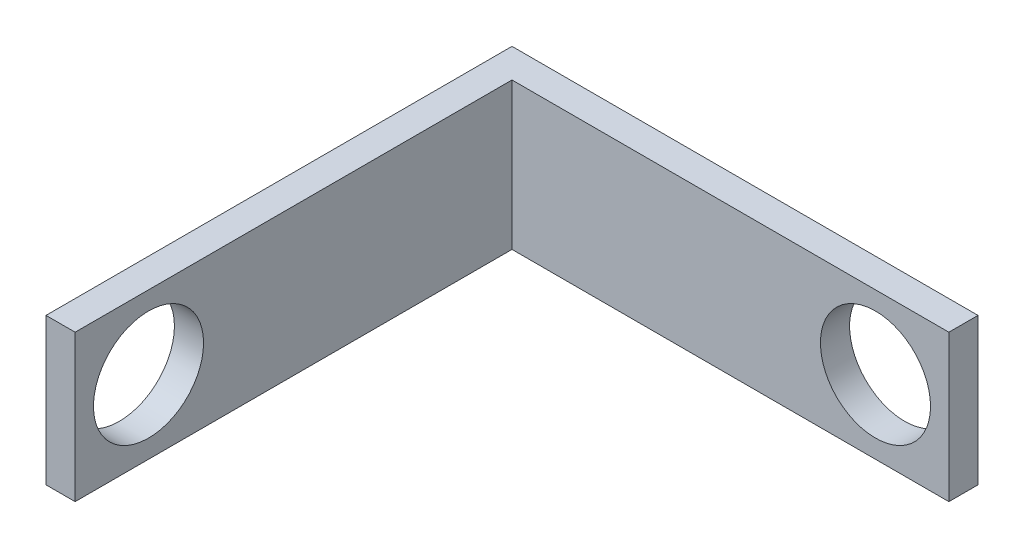
from build123d import *

# Parameters (mm, degrees)
BOSS_EXTRUDE1_DEPTH = 4
SKETCH2_R           = 3
CUT_EXTRUDE1_DEPTH  = 33.264456547
SKETCH3_R           = 3
CUT_EXTRUDE2_DEPTH  = 33.264456547


with BuildPart() as part:
    # Sketch1 → Boss-Extrude1 (new, symmetric)
    with BuildSketch(Plane(origin=(0, 0, 0), x_dir=(1, 0, 0), z_dir=(0, 1, 0))):
        Polygon((-4, 19.8125), (4, 19.8125), (4, 21.4), (-4, 21.4), (-21.4, 21.4), (-21.4, 4), (-21.4, -4), (-19.8125, -4), (-19.8125, 4), (-19.8125, 19.8125), align=None)
    extrude(amount=BOSS_EXTRUDE1_DEPTH, both=True)

    # Sketch2 → Cut-Extrude1 (cut, through all)
    with BuildSketch(Plane(origin=(-19.8125, 0, 0), x_dir=(0, 0, -1), z_dir=(1, 0, 0))):
        Circle(SKETCH2_R)
    extrude(amount=-CUT_EXTRUDE1_DEPTH, mode=Mode.SUBTRACT)

    # Sketch3 → Cut-Extrude2 (cut, through all)
    with BuildSketch(Plane.XY.offset(-19.8125)):
        Circle(SKETCH3_R)
    extrude(amount=-CUT_EXTRUDE2_DEPTH, mode=Mode.SUBTRACT)


solid = part.part
